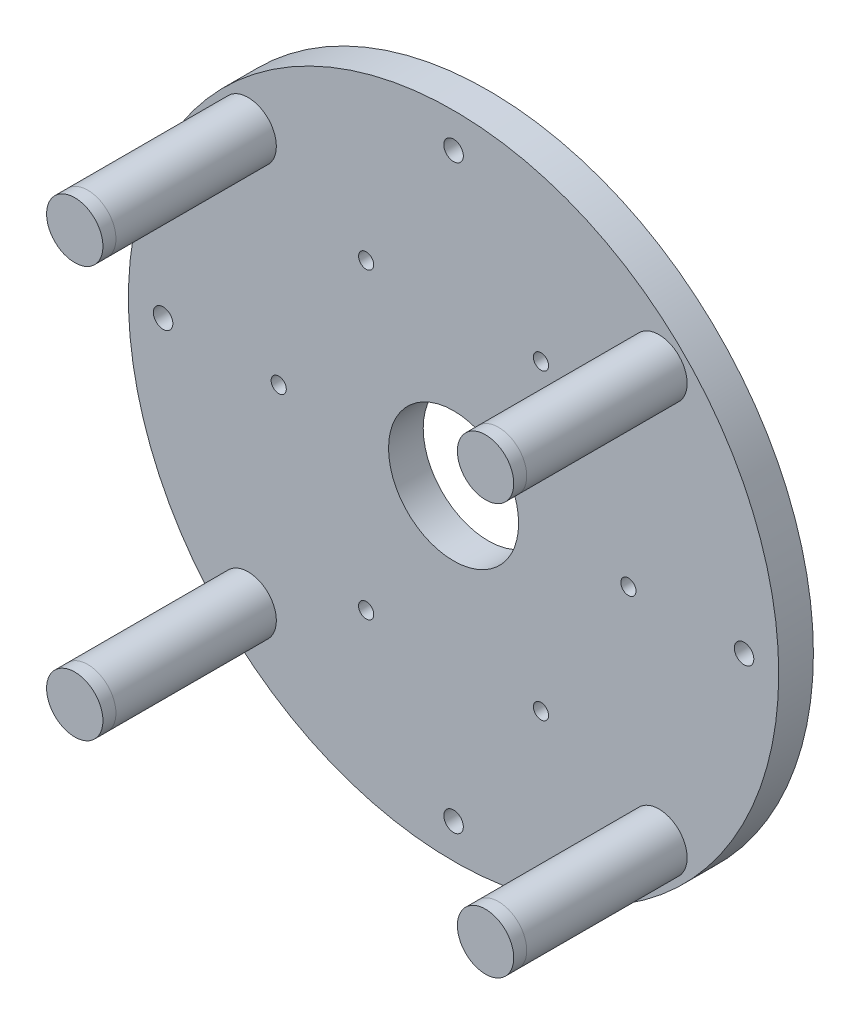
from build123d import *

# Parameters (mm, degrees)
SKETCH1_R           = 75
BOSS_EXTRUDE1_DEPTH = 8
SKETCH2_R           = 6.5
BOSS_EXTRUDE2_DEPTH = 40
CIRPATTERN1_COUNT   = 4
SKETCH3_R           = 15
CUT_EXTRUDE1_DEPTH  = 117.421647472
SKETCH4_R           = 2.25
CUT_EXTRUDE2_DEPTH  = 10
CIRPATTERN2_COUNT   = 8
SKETCH5_R           = 1.75
CUT_EXTRUDE3_DEPTH  = 117.421647472
CIRPATTERN3_COUNT   = 6


with BuildPart() as part:
    # Sketch1 → Boss-Extrude1 (new body)
    with BuildSketch(Plane.XY):
        Circle(SKETCH1_R)
    extrude(amount=BOSS_EXTRUDE1_DEPTH)

    # Sketch2 → Boss-Extrude2 (add)
    with BuildSketch(Plane.XY.offset(8)):
        with Locations((-47.376154339, 47.376154339)):
            Circle(SKETCH2_R)
    boss_extrude2 = extrude(amount=BOSS_EXTRUDE2_DEPTH)

    # CirPattern1: Boss-Extrude2 ×4 about axis
    cirpattern1_axis = Axis((0, 0, 0), (0, 0, 1))
    for i in range(1, CIRPATTERN1_COUNT):
        add(boss_extrude2.rotate(cirpattern1_axis, i * 360 / CIRPATTERN1_COUNT))


with BuildPart() as body_2:
    # Split1: the piece on the far side of the plane
    add(part.part)
    split(bisect_by=Plane.XY.offset(45), keep=Keep.BOTTOM)

    # Sketch3 → Cut-Extrude1 (cut, through all)
    with BuildSketch(Plane(origin=(0, 0, 0), x_dir=(-1, 0, 0), z_dir=(0, 0, -1))):
        Circle(SKETCH3_R)
    extrude(amount=-CUT_EXTRUDE1_DEPTH, mode=Mode.SUBTRACT)

    # Sketch4 → Cut-Extrude2 (cut)
    with BuildSketch(Plane(origin=(0, 0, 0), x_dir=(-1, 0, 0), z_dir=(0, 0, -1))):
        with Locations((47.376154339, 47.376154339)):
            Circle(SKETCH4_R)
    cut_extrude2 = extrude(amount=-CUT_EXTRUDE2_DEPTH, mode=Mode.SUBTRACT)

    # CirPattern2: Cut-Extrude2 ×8 about axis
    cirpattern2_axis = Axis((0, 0, 0), (0, 0, 1))
    for i in range(1, CIRPATTERN2_COUNT):
        add(cut_extrude2.rotate(cirpattern2_axis, i * 360 / CIRPATTERN2_COUNT), mode=Mode.SUBTRACT)

    # Sketch5 → Cut-Extrude3 (cut, through all)
    with BuildSketch(Plane(origin=(0, 0, 0), x_dir=(-1, 0, 0), z_dir=(0, 0, -1))):
        with Locations((-40.33, 0)):
            Circle(SKETCH5_R)
    cut_extrude3 = extrude(amount=-CUT_EXTRUDE3_DEPTH, mode=Mode.SUBTRACT)

    # CirPattern3: Cut-Extrude3 ×6 about axis
    cirpattern3_axis = Axis((0, 0, 0), (0, 0, 1))
    for i in range(1, CIRPATTERN3_COUNT):
        add(cut_extrude3.rotate(cirpattern3_axis, i * 360 / CIRPATTERN3_COUNT), mode=Mode.SUBTRACT)


with BuildPart() as part_1:
    add(part.part)

    # Split1
    split(bisect_by=Plane.XY.offset(45), keep=Keep.TOP)


solid = Compound([body_2.part, part_1.part])
